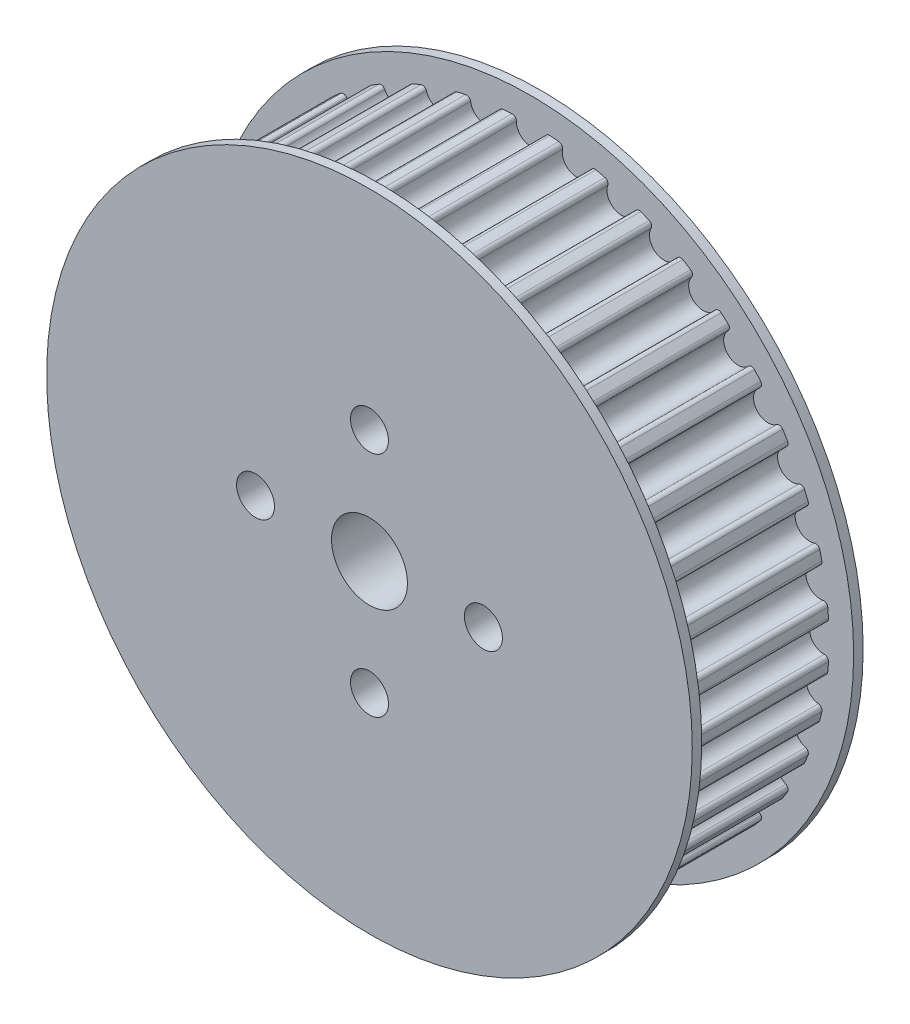
from build123d import *

# Parameters (mm, degrees)
BOSS_EXTRUDE1_DEPTH = 16
SKETCH2_R           = 34
BOSS_EXTRUDE2_DEPTH = 1
SKETCH3_R           = 4
SKETCH3_R_2         = 2
CUT_EXTRUDE1_DEPTH  = 52.341990612


with BuildPart() as part:
    # Sketch1 → Boss-Extrude1 (new body)
    with BuildSketch(Plane.XY):
        with BuildLine():
            ThreePointArc((0, 29.35), (1.090209609, 29.808666089), (1.524626197, 30.908763267))
            ThreePointArc((1.524626197, 30.908763267), (1.656759933, 31.228506655), (1.981649395, 31.347426779))
            ThreePointArc((1.981649395, 31.347426779), (2.464400197, 31.313173453), (2.946565936, 31.2714862))
            ThreePointArc((2.946565936, 31.2714862), (3.248852264, 31.103206271), (3.329340328, 30.766729184))
            ThreePointArc((3.329340328, 30.766729184), (3.586315414, 29.612218302), (4.591351549, 28.988652796))
            ThreePointArc((4.591351549, 28.988652796), (5.739890053, 29.271125588), (6.341051366, 30.289721017))
            ThreePointArc((6.341051366, 30.289721017), (6.521577201, 30.584857564), (6.861069941, 30.651489675))
            ThreePointArc((6.861069941, 30.651489675), (7.332518879, 30.5421392), (7.802227035, 30.425537847))
            ThreePointArc((7.802227035, 30.425537847), (8.074466935, 30.212041723), (8.101327445, 29.86711612))
            ThreePointArc((8.101327445, 29.86711612), (8.174533449, 28.686619423), (9.069648785, 27.913508753))
            ThreePointArc((9.069648785, 27.913508753), (10.248235354, 28.01283283), (11.001338804, 28.92484531))
            ThreePointArc((11.001338804, 28.92484531), (11.225811595, 29.188107774), (11.571548174, 29.200811168))
            ThreePointArc((11.571548174, 29.200811168), (12.020086611, 29.019056116), (12.46577141, 28.830411776))
            ThreePointArc((12.46577141, 28.830411776), (12.701261433, 28.57695644), (12.673832993, 28.232075534))
            ThreePointArc((12.673832993, 28.232075534), (12.56146734, 27.054660768), (13.324621167, 26.151041485))
            ThreePointArc((13.324621167, 26.151041485), (14.504235088, 26.064771158), (15.390736771, 26.847743916))
            ThreePointArc((15.390736771, 26.847743916), (15.653629251, 27.072649901), (15.997096488, 27.031111778))
            ThreePointArc((15.997096488, 27.031111778), (16.411679918, 26.781427562), (16.822367121, 26.525385284))
            ThreePointArc((16.822367121, 26.525385284), (17.015308722, 26.238211648), (16.934266711, 25.901867552))
            ThreePointArc((16.934266711, 25.901867552), (16.639096217, 24.756526576), (17.251497155, 23.744648785))
            ThreePointArc((17.251497155, 23.744648785), (18.403092419, 23.474908316), (19.401163718, 24.109561964))
            ThreePointArc((19.401163718, 24.109561964), (19.696002604, 24.290573538), (20.028743195, 24.195816705))
            ThreePointArc((20.028743195, 24.195816705), (20.399163198, 23.884351379), (20.764740323, 23.567215773))
            ThreePointArc((20.764740323, 23.567215773), (20.910382639, 23.253395005), (20.777722581, 22.933869627))
            ThreePointArc((20.777722581, 22.933869627), (20.307015323, 21.848804537), (20.753584028, 20.753584028))
            ThreePointArc((20.753584028, 20.753584028), (21.848804537, 20.307015323), (22.933869627, 20.777722581))
            ThreePointArc((22.933869627, 20.777722581), (23.253395005, 20.910382639), (23.567215773, 20.764740323))
            ThreePointArc((23.567215773, 20.764740323), (23.884351379, 20.399163198), (24.195816705, 20.028743195))
            ThreePointArc((24.195816705, 20.028743195), (24.290573538, 19.696002604), (24.109561964, 19.401163718))
            ThreePointArc((24.109561964, 19.401163718), (23.474908316, 18.403092419), (23.744648785, 17.251497155))
            ThreePointArc((23.744648785, 17.251497155), (24.756526576, 16.639096217), (25.901867552, 16.934266711))
            ThreePointArc((25.901867552, 16.934266711), (26.238211648, 17.015308722), (26.525385284, 16.822367121))
            ThreePointArc((26.525385284, 16.822367121), (26.781427562, 16.411679918), (27.031111778, 15.997096488))
            ThreePointArc((27.031111778, 15.997096488), (27.072649901, 15.653629251), (26.847743916, 15.390736771))
            ThreePointArc((26.847743916, 15.390736771), (26.064771158, 14.504235088), (26.151041485, 13.324621167))
            ThreePointArc((26.151041485, 13.324621167), (27.054660768, 12.56146734), (28.232075534, 12.673832993))
            ThreePointArc((28.232075534, 12.673832993), (28.57695644, 12.701261433), (28.830411776, 12.46577141))
            ThreePointArc((28.830411776, 12.46577141), (29.019056116, 12.020086611), (29.200811168, 11.571548174))
            ThreePointArc((29.200811168, 11.571548174), (29.188107774, 11.225811595), (28.92484531, 11.001338804))
            ThreePointArc((28.92484531, 11.001338804), (28.01283283, 10.248235354), (27.913508753, 9.069648785))
            ThreePointArc((27.913508753, 9.069648785), (28.686619423, 8.174533449), (29.86711612, 8.101327445))
            ThreePointArc((29.86711612, 8.101327445), (30.212041723, 8.074466935), (30.425537847, 7.802227035))
            ThreePointArc((30.425537847, 7.802227035), (30.5421392, 7.332518879), (30.651489675, 6.861069941))
            ThreePointArc((30.651489675, 6.861069941), (30.584857564, 6.521577201), (30.289721017, 6.341051366))
            ThreePointArc((30.289721017, 6.341051366), (29.271125588, 5.739890053), (28.988652796, 4.591351549))
            ThreePointArc((28.988652796, 4.591351549), (29.612218302, 3.586315414), (30.766729184, 3.329340328))
            ThreePointArc((30.766729184, 3.329340328), (31.103206271, 3.248852264), (31.2714862, 2.946565936))
            ThreePointArc((31.2714862, 2.946565936), (31.313173453, 2.464400197), (31.347426779, 1.981649395))
            ThreePointArc((31.347426779, 1.981649395), (31.228506655, 1.656759933), (30.908763267, 1.524626197))
            ThreePointArc((30.908763267, 1.524626197), (29.808666089, 1.090209609), (29.35, 0))
            ThreePointArc((29.35, 0), (29.808666089, -1.090209609), (30.908763267, -1.524626197))
            ThreePointArc((30.908763267, -1.524626197), (31.228506655, -1.656759933), (31.347426779, -1.981649395))
            ThreePointArc((31.347426779, -1.981649395), (31.313173453, -2.464400197), (31.2714862, -2.946565936))
            ThreePointArc((31.2714862, -2.946565936), (31.103206271, -3.248852264), (30.766729184, -3.329340328))
            ThreePointArc((30.766729184, -3.329340328), (29.612218302, -3.586315414), (28.988652796, -4.591351549))
            ThreePointArc((28.988652796, -4.591351549), (29.271125588, -5.739890053), (30.289721017, -6.341051366))
            ThreePointArc((30.289721017, -6.341051366), (30.584857564, -6.521577201), (30.651489675, -6.861069941))
            ThreePointArc((30.651489675, -6.861069941), (30.5421392, -7.332518879), (30.425537847, -7.802227035))
            ThreePointArc((30.425537847, -7.802227035), (30.212041723, -8.074466935), (29.86711612, -8.101327445))
            ThreePointArc((29.86711612, -8.101327445), (28.686619423, -8.174533449), (27.913508753, -9.069648785))
            ThreePointArc((27.913508753, -9.069648785), (28.01283283, -10.248235354), (28.92484531, -11.001338804))
            ThreePointArc((28.92484531, -11.001338804), (29.188107774, -11.225811595), (29.200811168, -11.571548174))
            ThreePointArc((29.200811168, -11.571548174), (29.019056116, -12.020086611), (28.830411776, -12.46577141))
            ThreePointArc((28.830411776, -12.46577141), (28.57695644, -12.701261433), (28.232075534, -12.673832993))
            ThreePointArc((28.232075534, -12.673832993), (27.054660768, -12.56146734), (26.151041485, -13.324621167))
            ThreePointArc((26.151041485, -13.324621167), (26.064771158, -14.504235088), (26.847743916, -15.390736771))
            ThreePointArc((26.847743916, -15.390736771), (27.072649901, -15.653629251), (27.031111778, -15.997096488))
            ThreePointArc((27.031111778, -15.997096488), (26.781427562, -16.411679918), (26.525385284, -16.822367121))
            ThreePointArc((26.525385284, -16.822367121), (26.238211648, -17.015308722), (25.901867552, -16.934266711))
            ThreePointArc((25.901867552, -16.934266711), (24.756526576, -16.639096217), (23.744648785, -17.251497155))
            ThreePointArc((23.744648785, -17.251497155), (23.474908316, -18.403092419), (24.109561964, -19.401163718))
            ThreePointArc((24.109561964, -19.401163718), (24.290573538, -19.696002604), (24.195816705, -20.028743195))
            ThreePointArc((24.195816705, -20.028743195), (23.884351379, -20.399163198), (23.567215773, -20.764740323))
            ThreePointArc((23.567215773, -20.764740323), (23.253395005, -20.910382639), (22.933869627, -20.777722581))
            ThreePointArc((22.933869627, -20.777722581), (21.848804537, -20.307015323), (20.753584028, -20.753584028))
            ThreePointArc((20.753584028, -20.753584028), (20.307015323, -21.848804537), (20.777722581, -22.933869627))
            ThreePointArc((20.777722581, -22.933869627), (20.910382639, -23.253395005), (20.764740323, -23.567215773))
            ThreePointArc((20.764740323, -23.567215773), (20.399163198, -23.884351379), (20.028743195, -24.195816705))
            ThreePointArc((20.028743195, -24.195816705), (19.696002604, -24.290573538), (19.401163718, -24.109561964))
            ThreePointArc((19.401163718, -24.109561964), (18.403092419, -23.474908316), (17.251497155, -23.744648785))
            ThreePointArc((17.251497155, -23.744648785), (16.639096217, -24.756526576), (16.934266711, -25.901867552))
            ThreePointArc((16.934266711, -25.901867552), (17.015308722, -26.238211648), (16.822367121, -26.525385284))
            ThreePointArc((16.822367121, -26.525385284), (16.411679918, -26.781427562), (15.997096488, -27.031111778))
            ThreePointArc((15.997096488, -27.031111778), (15.653629251, -27.072649901), (15.390736771, -26.847743916))
            ThreePointArc((15.390736771, -26.847743916), (14.504235088, -26.064771158), (13.324621167, -26.151041485))
            ThreePointArc((13.324621167, -26.151041485), (12.56146734, -27.054660768), (12.673832993, -28.232075534))
            ThreePointArc((12.673832993, -28.232075534), (12.701261433, -28.57695644), (12.46577141, -28.830411776))
            ThreePointArc((12.46577141, -28.830411776), (12.020086611, -29.019056116), (11.571548174, -29.200811168))
            ThreePointArc((11.571548174, -29.200811168), (11.225811595, -29.188107774), (11.001338804, -28.92484531))
            ThreePointArc((11.001338804, -28.92484531), (10.248235354, -28.01283283), (9.069648785, -27.913508753))
            ThreePointArc((9.069648785, -27.913508753), (8.174533449, -28.686619423), (8.101327445, -29.86711612))
            ThreePointArc((8.101327445, -29.86711612), (8.074466935, -30.212041723), (7.802227035, -30.425537847))
            ThreePointArc((7.802227035, -30.425537847), (7.332518879, -30.5421392), (6.861069941, -30.651489675))
            ThreePointArc((6.861069941, -30.651489675), (6.521577201, -30.584857564), (6.341051366, -30.289721017))
            ThreePointArc((6.341051366, -30.289721017), (5.739890053, -29.271125588), (4.591351549, -28.988652796))
            ThreePointArc((4.591351549, -28.988652796), (3.586315414, -29.612218302), (3.329340328, -30.766729184))
            ThreePointArc((3.329340328, -30.766729184), (3.248852264, -31.103206271), (2.946565936, -31.2714862))
            ThreePointArc((2.946565936, -31.2714862), (2.464400197, -31.313173453), (1.981649395, -31.347426779))
            ThreePointArc((1.981649395, -31.347426779), (1.656759933, -31.228506655), (1.524626197, -30.908763267))
            ThreePointArc((1.524626197, -30.908763267), (1.090209609, -29.808666089), (0, -29.35))
            ThreePointArc((0, -29.35), (-1.090209609, -29.808666089), (-1.524626197, -30.908763267))
            ThreePointArc((-1.524626197, -30.908763267), (-1.656759933, -31.228506655), (-1.981649395, -31.347426779))
            ThreePointArc((-1.981649395, -31.347426779), (-2.464400197, -31.313173453), (-2.946565936, -31.2714862))
            ThreePointArc((-2.946565936, -31.2714862), (-3.248852264, -31.103206271), (-3.329340328, -30.766729184))
            ThreePointArc((-3.329340328, -30.766729184), (-3.586315414, -29.612218302), (-4.591351549, -28.988652796))
            ThreePointArc((-4.591351549, -28.988652796), (-5.739890053, -29.271125588), (-6.341051366, -30.289721017))
            ThreePointArc((-6.341051366, -30.289721017), (-6.521577201, -30.584857564), (-6.861069941, -30.651489675))
            ThreePointArc((-6.861069941, -30.651489675), (-7.332518879, -30.5421392), (-7.802227035, -30.425537847))
            ThreePointArc((-7.802227035, -30.425537847), (-8.074466935, -30.212041723), (-8.101327445, -29.86711612))
            ThreePointArc((-8.101327445, -29.86711612), (-8.174533449, -28.686619423), (-9.069648785, -27.913508753))
            ThreePointArc((-9.069648785, -27.913508753), (-10.248235354, -28.01283283), (-11.001338804, -28.92484531))
            ThreePointArc((-11.001338804, -28.92484531), (-11.225811595, -29.188107774), (-11.571548174, -29.200811168))
            ThreePointArc((-11.571548174, -29.200811168), (-12.020086611, -29.019056116), (-12.46577141, -28.830411776))
            ThreePointArc((-12.46577141, -28.830411776), (-12.701261433, -28.57695644), (-12.673832993, -28.232075534))
            ThreePointArc((-12.673832993, -28.232075534), (-12.56146734, -27.054660768), (-13.324621167, -26.151041485))
            ThreePointArc((-13.324621167, -26.151041485), (-14.504235088, -26.064771158), (-15.390736771, -26.847743916))
            ThreePointArc((-15.390736771, -26.847743916), (-15.653629251, -27.072649901), (-15.997096488, -27.031111778))
            ThreePointArc((-15.997096488, -27.031111778), (-16.411679918, -26.781427562), (-16.822367121, -26.525385284))
            ThreePointArc((-16.822367121, -26.525385284), (-17.015308722, -26.238211648), (-16.934266711, -25.901867552))
            ThreePointArc((-16.934266711, -25.901867552), (-16.639096217, -24.756526576), (-17.251497155, -23.744648785))
            ThreePointArc((-17.251497155, -23.744648785), (-18.403092419, -23.474908316), (-19.401163718, -24.109561964))
            ThreePointArc((-19.401163718, -24.109561964), (-19.696002604, -24.290573538), (-20.028743195, -24.195816705))
            ThreePointArc((-20.028743195, -24.195816705), (-20.399163198, -23.884351379), (-20.764740323, -23.567215773))
            ThreePointArc((-20.764740323, -23.567215773), (-20.910382639, -23.253395005), (-20.777722581, -22.933869627))
            ThreePointArc((-20.777722581, -22.933869627), (-20.307015323, -21.848804537), (-20.753584028, -20.753584028))
            ThreePointArc((-20.753584028, -20.753584028), (-21.848804537, -20.307015323), (-22.933869627, -20.777722581))
            ThreePointArc((-22.933869627, -20.777722581), (-23.253395005, -20.910382639), (-23.567215773, -20.764740323))
            ThreePointArc((-23.567215773, -20.764740323), (-23.884351379, -20.399163198), (-24.195816705, -20.028743195))
            ThreePointArc((-24.195816705, -20.028743195), (-24.290573538, -19.696002604), (-24.109561964, -19.401163718))
            ThreePointArc((-24.109561964, -19.401163718), (-23.474908316, -18.403092419), (-23.744648785, -17.251497155))
            ThreePointArc((-23.744648785, -17.251497155), (-24.756526576, -16.639096217), (-25.901867552, -16.934266711))
            ThreePointArc((-25.901867552, -16.934266711), (-26.238211648, -17.015308722), (-26.525385284, -16.822367121))
            ThreePointArc((-26.525385284, -16.822367121), (-26.781427562, -16.411679918), (-27.031111778, -15.997096488))
            ThreePointArc((-27.031111778, -15.997096488), (-27.072649901, -15.653629251), (-26.847743916, -15.390736771))
            ThreePointArc((-26.847743916, -15.390736771), (-26.064771158, -14.504235088), (-26.151041485, -13.324621167))
            ThreePointArc((-26.151041485, -13.324621167), (-27.054660768, -12.56146734), (-28.232075534, -12.673832993))
            ThreePointArc((-28.232075534, -12.673832993), (-28.57695644, -12.701261433), (-28.830411776, -12.46577141))
            ThreePointArc((-28.830411776, -12.46577141), (-29.019056116, -12.020086611), (-29.200811168, -11.571548174))
            ThreePointArc((-29.200811168, -11.571548174), (-29.188107774, -11.225811595), (-28.92484531, -11.001338804))
            ThreePointArc((-28.92484531, -11.001338804), (-28.01283283, -10.248235354), (-27.913508753, -9.069648785))
            ThreePointArc((-27.913508753, -9.069648785), (-28.686619423, -8.174533449), (-29.86711612, -8.101327445))
            ThreePointArc((-29.86711612, -8.101327445), (-30.212041723, -8.074466935), (-30.425537847, -7.802227035))
            ThreePointArc((-30.425537847, -7.802227035), (-30.5421392, -7.332518879), (-30.651489675, -6.861069941))
            ThreePointArc((-30.651489675, -6.861069941), (-30.584857564, -6.521577201), (-30.289721017, -6.341051366))
            ThreePointArc((-30.289721017, -6.341051366), (-29.271125588, -5.739890053), (-28.988652796, -4.591351549))
            ThreePointArc((-28.988652796, -4.591351549), (-29.612218302, -3.586315414), (-30.766729184, -3.329340328))
            ThreePointArc((-30.766729184, -3.329340328), (-31.103206271, -3.248852264), (-31.2714862, -2.946565936))
            ThreePointArc((-31.2714862, -2.946565936), (-31.313173453, -2.464400197), (-31.347426779, -1.981649395))
            ThreePointArc((-31.347426779, -1.981649395), (-31.228506655, -1.656759933), (-30.908763267, -1.524626197))
            ThreePointArc((-30.908763267, -1.524626197), (-29.808666089, -1.090209609), (-29.35, 0))
            ThreePointArc((-29.35, 0), (-29.808666089, 1.090209609), (-30.908763267, 1.524626197))
            ThreePointArc((-30.908763267, 1.524626197), (-31.228506655, 1.656759933), (-31.347426779, 1.981649395))
            ThreePointArc((-31.347426779, 1.981649395), (-31.313173453, 2.464400197), (-31.2714862, 2.946565936))
            ThreePointArc((-31.2714862, 2.946565936), (-31.103206271, 3.248852264), (-30.766729184, 3.329340328))
            ThreePointArc((-30.766729184, 3.329340328), (-29.612218302, 3.586315414), (-28.988652796, 4.591351549))
            ThreePointArc((-28.988652796, 4.591351549), (-29.271125588, 5.739890053), (-30.289721017, 6.341051366))
            ThreePointArc((-30.289721017, 6.341051366), (-30.584857564, 6.521577201), (-30.651489675, 6.861069941))
            ThreePointArc((-30.651489675, 6.861069941), (-30.5421392, 7.332518879), (-30.425537847, 7.802227035))
            ThreePointArc((-30.425537847, 7.802227035), (-30.212041723, 8.074466935), (-29.86711612, 8.101327445))
            ThreePointArc((-29.86711612, 8.101327445), (-28.686619423, 8.174533449), (-27.913508753, 9.069648785))
            ThreePointArc((-27.913508753, 9.069648785), (-28.01283283, 10.248235354), (-28.92484531, 11.001338804))
            ThreePointArc((-28.92484531, 11.001338804), (-29.188107774, 11.225811595), (-29.200811168, 11.571548174))
            ThreePointArc((-29.200811168, 11.571548174), (-29.019056116, 12.020086611), (-28.830411776, 12.46577141))
            ThreePointArc((-28.830411776, 12.46577141), (-28.57695644, 12.701261433), (-28.232075534, 12.673832993))
            ThreePointArc((-28.232075534, 12.673832993), (-27.054660768, 12.56146734), (-26.151041485, 13.324621167))
            ThreePointArc((-26.151041485, 13.324621167), (-26.064771158, 14.504235088), (-26.847743916, 15.390736771))
            ThreePointArc((-26.847743916, 15.390736771), (-27.072649901, 15.653629251), (-27.031111778, 15.997096488))
            ThreePointArc((-27.031111778, 15.997096488), (-26.781427562, 16.411679918), (-26.525385284, 16.822367121))
            ThreePointArc((-26.525385284, 16.822367121), (-26.238211648, 17.015308722), (-25.901867552, 16.934266711))
            ThreePointArc((-25.901867552, 16.934266711), (-24.756526576, 16.639096217), (-23.744648785, 17.251497155))
            ThreePointArc((-23.744648785, 17.251497155), (-23.474908316, 18.403092419), (-24.109561964, 19.401163718))
            ThreePointArc((-24.109561964, 19.401163718), (-24.290573538, 19.696002604), (-24.195816705, 20.028743195))
            ThreePointArc((-24.195816705, 20.028743195), (-23.884351379, 20.399163198), (-23.567215773, 20.764740323))
            ThreePointArc((-23.567215773, 20.764740323), (-23.253395005, 20.910382639), (-22.933869627, 20.777722581))
            ThreePointArc((-22.933869627, 20.777722581), (-21.848804537, 20.307015323), (-20.753584028, 20.753584028))
            ThreePointArc((-20.753584028, 20.753584028), (-20.307015323, 21.848804537), (-20.777722581, 22.933869627))
            ThreePointArc((-20.777722581, 22.933869627), (-20.910382639, 23.253395005), (-20.764740323, 23.567215773))
            ThreePointArc((-20.764740323, 23.567215773), (-20.399163198, 23.884351379), (-20.028743195, 24.195816705))
            ThreePointArc((-20.028743195, 24.195816705), (-19.696002604, 24.290573538), (-19.401163718, 24.109561964))
            ThreePointArc((-19.401163718, 24.109561964), (-18.403092419, 23.474908316), (-17.251497155, 23.744648785))
            ThreePointArc((-17.251497155, 23.744648785), (-16.639096217, 24.756526576), (-16.934266711, 25.901867552))
            ThreePointArc((-16.934266711, 25.901867552), (-17.015308722, 26.238211648), (-16.822367121, 26.525385284))
            ThreePointArc((-16.822367121, 26.525385284), (-16.411679918, 26.781427562), (-15.997096488, 27.031111778))
            ThreePointArc((-15.997096488, 27.031111778), (-15.653629251, 27.072649901), (-15.390736771, 26.847743916))
            ThreePointArc((-15.390736771, 26.847743916), (-14.504235088, 26.064771158), (-13.324621167, 26.151041485))
            ThreePointArc((-13.324621167, 26.151041485), (-12.56146734, 27.054660768), (-12.673832993, 28.232075534))
            ThreePointArc((-12.673832993, 28.232075534), (-12.701261433, 28.57695644), (-12.46577141, 28.830411776))
            ThreePointArc((-12.46577141, 28.830411776), (-12.020086611, 29.019056116), (-11.571548174, 29.200811168))
            ThreePointArc((-11.571548174, 29.200811168), (-11.225811595, 29.188107774), (-11.001338804, 28.92484531))
            ThreePointArc((-11.001338804, 28.92484531), (-10.248235354, 28.01283283), (-9.069648785, 27.913508753))
            ThreePointArc((-9.069648785, 27.913508753), (-8.174533449, 28.686619423), (-8.101327445, 29.86711612))
            ThreePointArc((-8.101327445, 29.86711612), (-8.074466935, 30.212041723), (-7.802227035, 30.425537847))
            ThreePointArc((-7.802227035, 30.425537847), (-7.332518879, 30.5421392), (-6.861069941, 30.651489675))
            ThreePointArc((-6.861069941, 30.651489675), (-6.521577201, 30.584857564), (-6.341051366, 30.289721017))
            ThreePointArc((-6.341051366, 30.289721017), (-5.739890053, 29.271125588), (-4.591351549, 28.988652796))
            ThreePointArc((-4.591351549, 28.988652796), (-3.586315414, 29.612218302), (-3.329340328, 30.766729184))
            ThreePointArc((-3.329340328, 30.766729184), (-3.248852264, 31.103206271), (-2.946565936, 31.2714862))
            ThreePointArc((-2.946565936, 31.2714862), (-2.464400197, 31.313173453), (-1.981649395, 31.347426779))
            ThreePointArc((-1.981649395, 31.347426779), (-1.656759933, 31.228506655), (-1.524626197, 30.908763267))
            ThreePointArc((-1.524626197, 30.908763267), (-1.090209609, 29.808666089), (0, 29.35))
        make_face()
    extrude(amount=BOSS_EXTRUDE1_DEPTH)

    # Sketch2 → Boss-Extrude2 (add)
    with BuildSketch(Plane.XY.offset(16)):
        Circle(SKETCH2_R)
    boss_extrude2 = extrude(amount=BOSS_EXTRUDE2_DEPTH)

    # Mirror1: Boss-Extrude2 across plane
    add(boss_extrude2.mirror(Plane(origin=(0, 0, 8), x_dir=(1, 0, 0), z_dir=(0, 0, -1))))

    # Sketch3 → Cut-Extrude1 (cut, through all)
    with BuildSketch(Plane.XY.offset(17)):
        Circle(SKETCH3_R)
        with Locations((12, 0)):
            Circle(SKETCH3_R_2)
        with Locations((0, -12)):
            Circle(SKETCH3_R_2)
        with Locations((-12, 0)):
            Circle(SKETCH3_R_2)
        with Locations((0, 12)):
            Circle(SKETCH3_R_2)
    extrude(amount=-CUT_EXTRUDE1_DEPTH, mode=Mode.SUBTRACT)


solid = part.part
